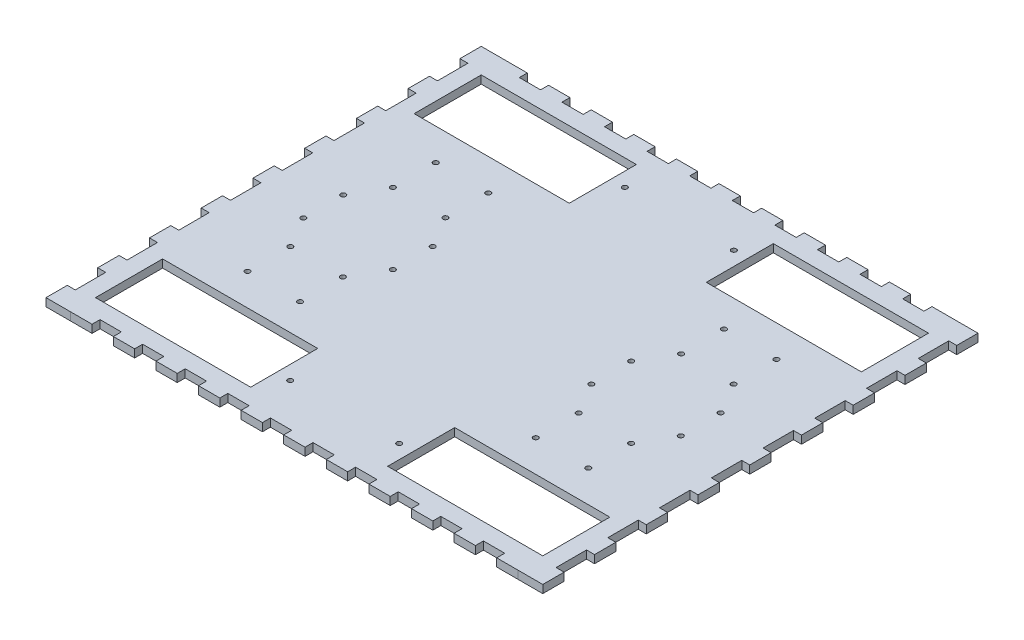
from build123d import *

# Parameters (mm, degrees)
BOSS_EXTRUDE1_DEPTH = 4.7625
SKETCH5_R           = 1.5
CUT_EXTRUDE1_DEPTH  = 297.63087805
SKETCH7_W           = 92.5
SKETCH7_H           = 40
CUT_EXTRUDE2_DEPTH  = 297.63087805
BOSS_EXTRUDE2_DEPTH = 4.7625


with BuildPart() as part:
    # Sketch2 → Boss-Extrude1 (new body)
    with BuildSketch(Plane(origin=(0, 0, 0), x_dir=(1, 0, 0), z_dir=(0, 1, 0))):
        Polygon((25.4, 125), (25.4, 129.7625), (38.1, 129.7625), (38.1, 125), (50.8, 125), (50.8, 129.7625), (63.5, 129.7625), (63.5, 125), (76.2, 125), (76.2, 129.7625), (88.9, 129.7625), (88.9, 125), (101.6, 125), (101.6, 129.7625), (114.3, 129.7625), (114.3, 125), (127, 125), (127, 129.7625), (139.7, 129.7625), (139.7, 125), (152.4, 125), (152.4, 129.7625), (165.1, 129.7625), (165.1, 125), (177.8, 125), (177.8, 129.7625), (190.5, 129.7625), (190.5, 125), (203.2, 125), (203.2, 129.7625), (215.9, 129.7625), (215.9, 125), (228.6, 125), (228.6, 129.7625), (241.3, 129.7625), (241.3, 125), (254, 125), (254, 129.7625), (266.7, 129.7625), (266.7, 125), (266.7, -125), (266.7, -129.7625), (254, -129.7625), (254, -125), (241.3, -125), (241.3, -129.7625), (228.6, -129.7625), (228.6, -125), (215.9, -125), (215.9, -129.7625), (203.2, -129.7625), (203.2, -125), (190.5, -125), (190.5, -129.7625), (177.8, -129.7625), (177.8, -125), (165.1, -125), (165.1, -129.7625), (152.4, -129.7625), (152.4, -125), (139.7, -125), (139.7, -129.7625), (127, -129.7625), (127, -125), (114.3, -125), (114.3, -129.7625), (101.6, -129.7625), (101.6, -125), (88.9, -125), (88.9, -129.7625), (76.2, -129.7625), (76.2, -125), (63.5, -125), (63.5, -129.7625), (50.8, -129.7625), (50.8, -125), (38.1, -125), (38.1, -129.7625), (25.4, -129.7625), (25.4, -125), (12.7, -125), (12.7, -129.7625), (0, -129.7625), (0, -125), (0, 125), (0, 129.7625), (12.7, 129.7625), (12.7, 125), align=None)
    extrude(amount=BOSS_EXTRUDE1_DEPTH)

    # Sketch5 → Cut-Extrude1 (cut, through all)
    with BuildSketch(Plane(origin=(0, 4.7625, 0), x_dir=(1, 0, 0), z_dir=(0, 1, 0))):
        with Locations(Location((31.75, 56.1125, 0), (0, 0, 270))):
            Circle(SKETCH5_R)
        with Locations(Location((63.07, 56.1125, 0), (0, 0, 270))):
            Circle(SKETCH5_R)
        with Locations(Location((63.07, 30.5625, 0), (0, 0, 270))):
            Circle(SKETCH5_R)
        with Locations(Location((31.75, 30.5625, 0), (0, 0, 270))):
            Circle(SKETCH5_R)
        with Locations(Location((203.63, 56.1125, 0), (0, 0, 270))):
            Circle(SKETCH5_R)
        with Locations(Location((203.63, 30.5625, 0), (0, 0, 270))):
            Circle(SKETCH5_R)
        with Locations(Location((234.95, 30.5625, 0), (0, 0, 270))):
            Circle(SKETCH5_R)
        with Locations(Location((234.95, 56.1125, 0), (0, 0, 270))):
            Circle(SKETCH5_R)
        with Locations(Location((234.95, -56.1125, 0), (0, 0, 270))):
            Circle(SKETCH5_R)
        with Locations(Location((234.95, -30.5625, 0), (0, 0, 270))):
            Circle(SKETCH5_R)
        with Locations(Location((203.63, -30.5625, 0), (0, 0, 270))):
            Circle(SKETCH5_R)
        with Locations(Location((203.63, -56.1125, 0), (0, 0, 270))):
            Circle(SKETCH5_R)
        with Locations(Location((31.75, -30.5625, 0), (0, 0, 270))):
            Circle(SKETCH5_R)
        with Locations(Location((63.07, -30.5625, 0), (0, 0, 270))):
            Circle(SKETCH5_R)
        with Locations(Location((63.07, -56.1125, 0), (0, 0, 270))):
            Circle(SKETCH5_R)
        with Locations(Location((31.75, -56.1125, 0), (0, 0, 270))):
            Circle(SKETCH5_R)
        with Locations(Location((20.83, 11.885, 0), (0, 0, 270))):
            Circle(SKETCH5_R)
        with Locations(Location((74.17, 11.885, 0), (0, 0, 270))):
            Circle(SKETCH5_R)
        with Locations(Location((192.53, 11.885, 0), (0, 0, 270))):
            Circle(SKETCH5_R)
        with Locations(Location((245.87, 11.885, 0), (0, 0, 270))):
            Circle(SKETCH5_R)
        with Locations(Location((245.87, -11.885, 0), (0, 0, 270))):
            Circle(SKETCH5_R)
        with Locations(Location((192.53, -11.885, 0), (0, 0, 270))):
            Circle(SKETCH5_R)
        with Locations(Location((74.17, -11.885, 0), (0, 0, 270))):
            Circle(SKETCH5_R)
        with Locations(Location((20.83, -11.885, 0), (0, 0, 270))):
            Circle(SKETCH5_R)
        with Locations(Location((100.85, 99.7625, 0), (0, 0, 270))):
            Circle(SKETCH5_R)
        with Locations(Location((165.85, 99.7625, 0), (0, 0, 270))):
            Circle(SKETCH5_R)
        with Locations(Location((165.85, -99.7625, 0), (0, 0, 270))):
            Circle(SKETCH5_R)
        with Locations(Location((100.85, -99.7625, 0), (0, 0, 270))):
            Circle(SKETCH5_R)
    extrude(amount=-CUT_EXTRUDE1_DEPTH, mode=Mode.SUBTRACT)

    # Sketch7 → Cut-Extrude2 (cut, through all)
    with BuildSketch(Plane(origin=(0, 4.7625, 0), x_dir=(1, 0, 0), z_dir=(0, 1, 0))):
        with Locations((46.25, 95)):
            Rectangle(SKETCH7_W, SKETCH7_H)
        with Locations((220.45, 95)):
            Rectangle(SKETCH7_W, SKETCH7_H)
        with Locations((46.25, -95)):
            Rectangle(SKETCH7_W, SKETCH7_H)
        with Locations((220.45, -95)):
            Rectangle(SKETCH7_W, SKETCH7_H)
    extrude(amount=-CUT_EXTRUDE2_DEPTH, mode=Mode.SUBTRACT)

    # Sketch8 → Boss-Extrude2 (add)
    with BuildSketch(Plane(origin=(0, 4.7625, 0), x_dir=(1, 0, 0), z_dir=(0, 1, 0))):
        Polygon((-14.76, -129.76), (0, -129.76), (0, 129.76), (-14.76, 129.76), (-14.76, 117.06), (-10, 117.06), (-10, 98.9075), (-14.76, 98.9075), (-14.76, 86.2075), (-10, 86.2075), (-10, 68.055), (-14.76, 68.055), (-14.76, 55.355), (-10, 55.355), (-10, 37.2025), (-14.76, 37.2025), (-14.76, 24.5025), (-10, 24.5025), (-10, 6.35), (-14.76, 6.35), (-14.76, -6.35), (-10, -6.35), (-10, -24.5025), (-14.76, -24.5025), (-14.76, -37.2025), (-10, -37.2025), (-10, -55.355), (-14.76, -55.355), (-14.76, -68.055), (-10, -68.055), (-10, -86.2075), (-14.76, -86.2075), (-14.76, -98.9075), (-10, -98.9075), (-10, -117.06), (-14.76, -117.06), align=None)
        Polygon((281.46, -86.2075), (276.7, -86.2075), (276.7, -68.055), (281.46, -68.055), (281.46, -55.355), (276.7, -55.355), (276.7, -37.2025), (281.46, -37.2025), (281.46, -24.5025), (276.7, -24.5025), (276.7, -6.35), (281.46, -6.35), (281.46, 6.35), (276.7, 6.35), (276.7, 24.5025), (281.46, 24.5025), (281.46, 37.2025), (276.7, 37.2025), (276.7, 55.355), (281.46, 55.355), (281.46, 68.055), (276.7, 68.055), (276.7, 86.2075), (281.46, 86.2075), (281.46, 98.9075), (276.7, 98.9075), (276.7, 117.06), (281.46, 117.06), (281.46, 129.76), (266.7, 129.76), (266.7, -129.76), (281.46, -129.76), (281.46, -117.06), (276.7, -117.06), (276.7, -98.9075), (281.46, -98.9075), align=None)
    extrude(amount=-BOSS_EXTRUDE2_DEPTH)


solid = part.part
